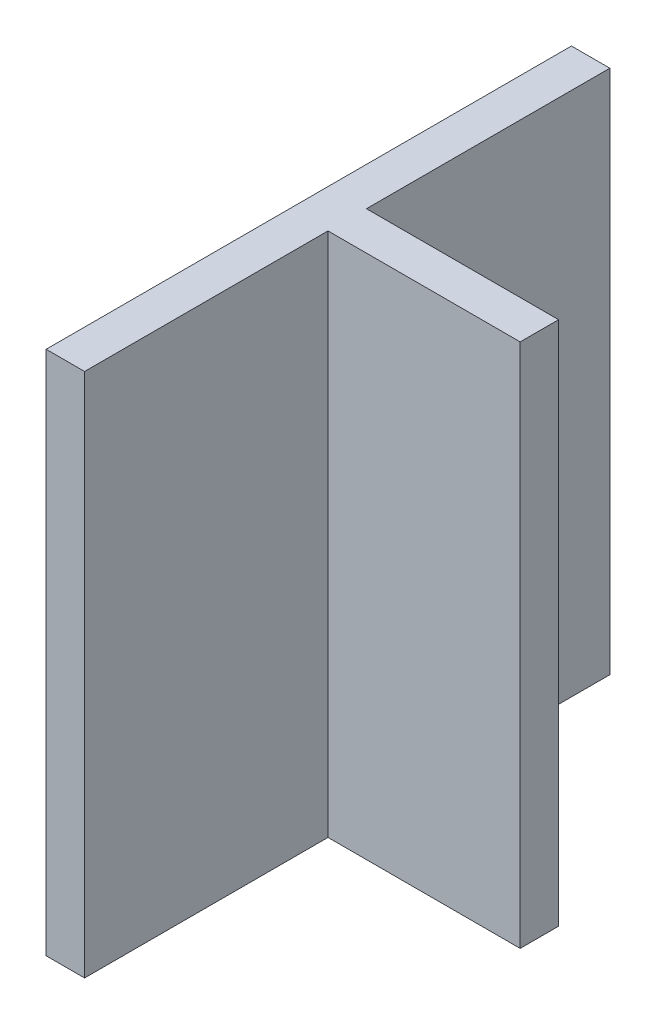
from build123d import *

# Parameters (mm, degrees)
BOSS_EXTRUDE1_DEPTH = 41


with BuildPart() as part:
    # Sketch1 → Boss-Extrude1 (new body)
    with BuildSketch(Plane(origin=(0, 0, 0), x_dir=(1, 0, 0), z_dir=(0, 1, 0))):
        Polygon((0, 20.5), (3, 20.5), (3, 1.5), (18, 1.5), (18, -1.5), (3, -1.5), (3, -20.5), (0, -20.5), align=None)
    extrude(amount=BOSS_EXTRUDE1_DEPTH)


solid = part.part
